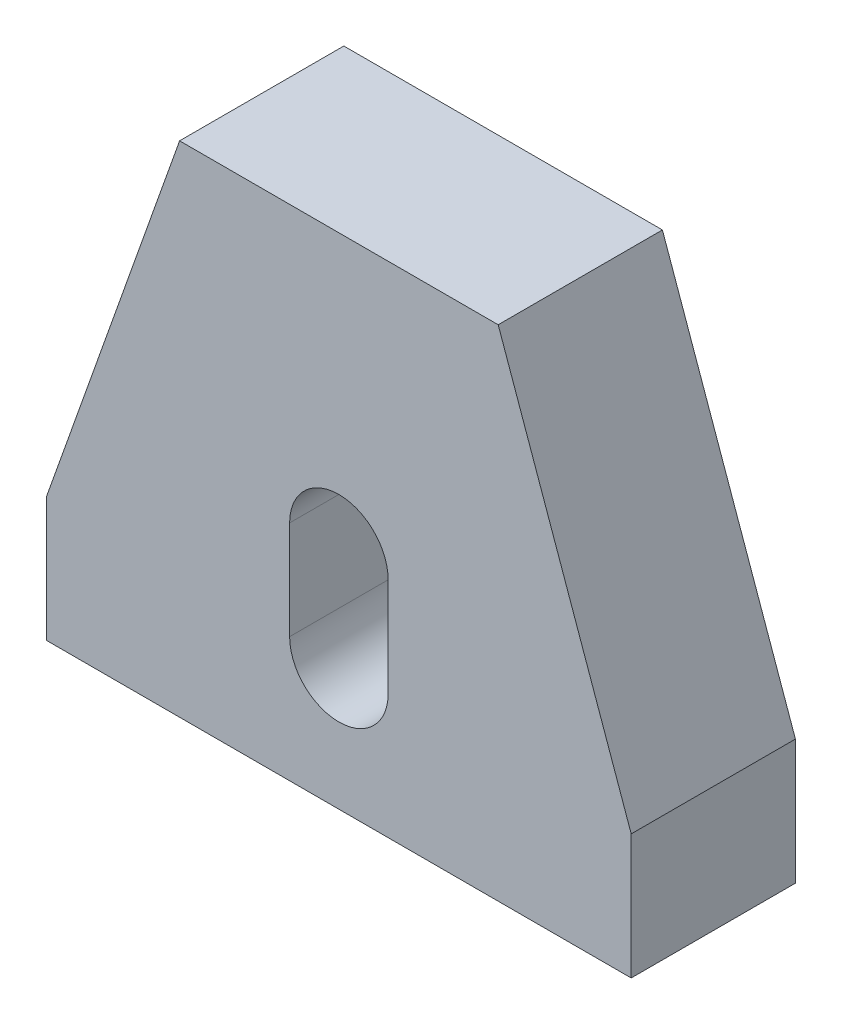
from build123d import *

# Parameters (mm, degrees)
BOSS_EXTRUDE1_DEPTH = 2.5


with BuildPart() as part:
    # Sketch1 → Boss-Extrude1 (new, symmetric)
    with BuildSketch(Plane.XY):
        Polygon((-4.85, 8.4), (4.85, 8.4), (8.9, -3), (8.9, -6.8), (-8.9, -6.8), (-8.9, -3), align=None)
        with BuildLine():
            Line((1.5, 0), (1.5, -3))
            ThreePointArc((1.5, -3), (0, -4.5), (-1.5, -3))
            Line((-1.5, -3), (-1.5, 0))
            ThreePointArc((-1.5, 0), (0, 1.5), (1.5, 0))
        make_face(mode=Mode.SUBTRACT)
    extrude(amount=BOSS_EXTRUDE1_DEPTH, both=True)


solid = part.part
